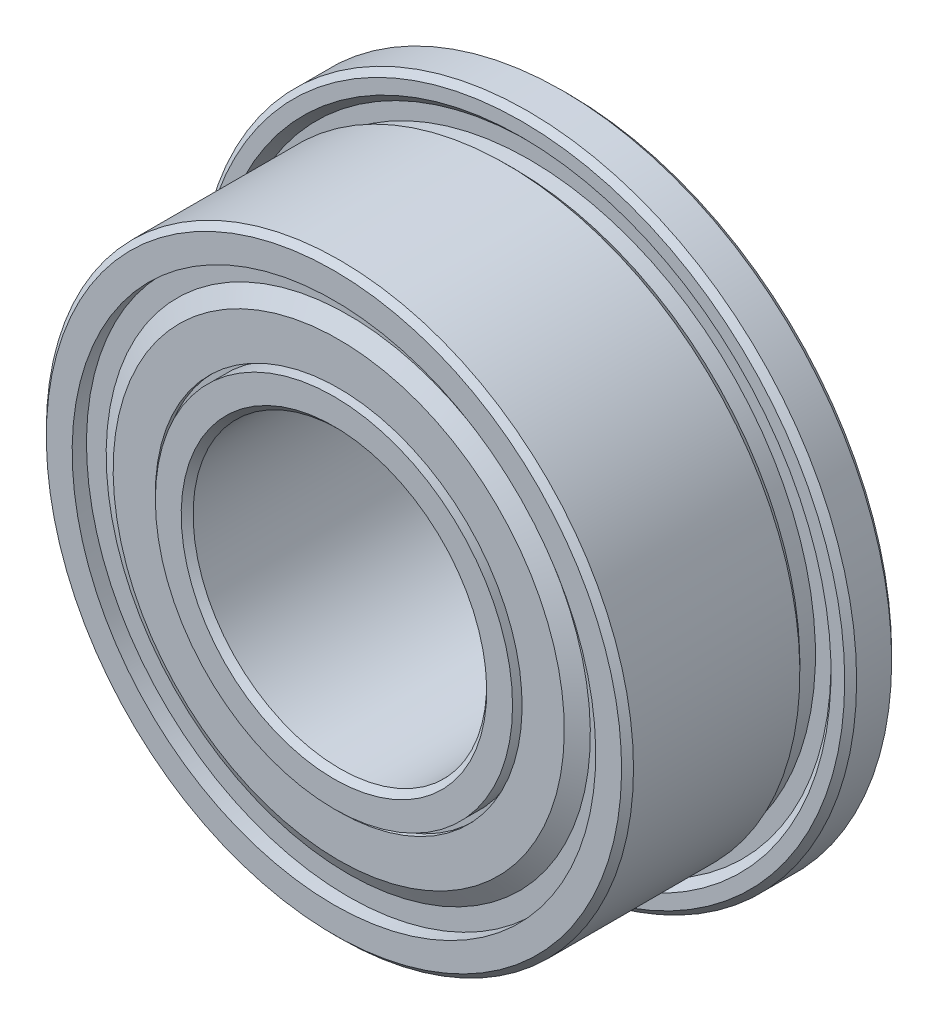
from build123d import *

# Parameters (mm, degrees)
FILLET1_SIZE      = 0.1015625
FILLET2_SIZE      = 0.1015625
CIRPATTERN3_COUNT = 16
SKETCH8_W         = 0.325
SKETCH8_H         = 0.270833333


with BuildPart() as part:
    # Sketch2 → Revolve1 (revolve)
    with BuildSketch(Plane(origin=(0, 0, 0), x_dir=(0, 0, -1), z_dir=(1, 0, 0)), mode=Mode.PRIVATE) as revolve1_sk:
        with BuildLine():
            Line((2, 5.6), (1.2, 5.6))
            Line((1.2, 5.6), (1.2, 5.265165043))
            Line((1.2, 5.265165043), (1.332582521, 5.132582521))
            Line((1.332582521, 5.132582521), (1.332582521, 4.867417479))
            Line((1.332582521, 4.867417479), (1.067417479, 4.867417479))
            Line((1.067417479, 4.867417479), (0.934834957, 5))
            Line((0.934834957, 5), (-2, 5))
            Line((-2, 5), (-2, 4.1875))
            Line((-2, 4.1875), (-0.410601693, 4.1875))
            ThreePointArc((-0.410601693, 4.1875), (0, 4.35), (0.410601693, 4.1875))
            Line((0.410601693, 4.1875), (2, 4.1875))
            Line((2, 4.1875), (2, 5.6))
        make_face()
        with BuildLine():
            Line((2, 2.5), (-2, 2.5))
            Line((-2, 2.5), (-2, 3.3125))
            Line((-2, 3.3125), (-0.410601693, 3.3125))
            ThreePointArc((-0.410601693, 3.3125), (0, 3.15), (0.410601693, 3.3125))
            Line((0.410601693, 3.3125), (2, 3.3125))
            Line((2, 3.3125), (2, 2.5))
        make_face()
    revolve(revolve1_sk.sketch.rotate(Axis((0, 0, 0), (0, 0, -1)), 180), axis=Axis((0, 0, 0), (0, 0, -1)))

    # Fillet1
    fillet1_edges = [part.edges().sort_by_distance(p)[0] for p in [
        (0, 5, 2),
        (0, 5.6, -2),
        (0, 5.6, -1.2),
    ]]
    chamfer(fillet1_edges, length=FILLET1_SIZE)

    # Fillet2
    fillet2_edges = [part.edges().sort_by_distance(p)[0] for p in [
        (0, 2.5, -2),
        (0, 2.5, 2),
    ]]
    chamfer(fillet2_edges, length=FILLET2_SIZE)

    # Sketch8 → Cut-Revolve1 (revolve, cut)
    with BuildSketch(Plane(origin=(0, 0, 0), x_dir=(0, 0, -1), z_dir=(1, 0, 0)), mode=Mode.PRIVATE) as cut_revolve1_sk:
        with Locations((-1.8375, 4.322916667)):
            Rectangle(SKETCH8_W, SKETCH8_H)
        with Locations((1.8375, 4.322916667)):
            Rectangle(SKETCH8_W, SKETCH8_H)
        with Locations((1.8375, 3.177083334)):
            Rectangle(SKETCH8_W, SKETCH8_H)
        with Locations((-1.8375, 3.177083334)):
            Rectangle(SKETCH8_W, SKETCH8_H)
    revolve(cut_revolve1_sk.sketch.rotate(Axis((0, 0, 0), (0, 0, -1)), 180), axis=Axis((0, 0, 0), (0, 0, -1)), mode=Mode.SUBTRACT)


with BuildPart() as body_2:
    # Sketch7 → Revolve3 (revolve)
    with BuildSketch(Plane.XY):
        with BuildLine():
            Line((0, 4.35), (0, 3.15))
            ThreePointArc((0, 3.15), (-0.6, 3.75), (0, 4.35))
        make_face()
    revolve(axis=Axis((0, 4.35, 0), (0, -1, 0)))


with BuildPart() as cirpattern3_1:
    # CirPattern3: pattern copy
    add(body_2.part.rotate(Axis((0, 0, 0), (0, 0, 1)), 1 * 360 / CIRPATTERN3_COUNT))


with BuildPart() as cirpattern3_2:
    # CirPattern3: pattern copy
    add(body_2.part.rotate(Axis((0, 0, 0), (0, 0, 1)), 2 * 360 / CIRPATTERN3_COUNT))


with BuildPart() as cirpattern3_3:
    # CirPattern3: pattern copy
    add(body_2.part.rotate(Axis((0, 0, 0), (0, 0, 1)), 3 * 360 / CIRPATTERN3_COUNT))


with BuildPart() as cirpattern3_4:
    # CirPattern3: pattern copy
    add(body_2.part.rotate(Axis((0, 0, 0), (0, 0, 1)), 4 * 360 / CIRPATTERN3_COUNT))


with BuildPart() as cirpattern3_5:
    # CirPattern3: pattern copy
    add(body_2.part.rotate(Axis((0, 0, 0), (0, 0, 1)), 5 * 360 / CIRPATTERN3_COUNT))


with BuildPart() as cirpattern3_6:
    # CirPattern3: pattern copy
    add(body_2.part.rotate(Axis((0, 0, 0), (0, 0, 1)), 6 * 360 / CIRPATTERN3_COUNT))


with BuildPart() as cirpattern3_7:
    # CirPattern3: pattern copy
    add(body_2.part.rotate(Axis((0, 0, 0), (0, 0, 1)), 7 * 360 / CIRPATTERN3_COUNT))


with BuildPart() as cirpattern3_8:
    # CirPattern3: pattern copy
    add(body_2.part.rotate(Axis((0, 0, 0), (0, 0, 1)), 8 * 360 / CIRPATTERN3_COUNT))


with BuildPart() as cirpattern3_9:
    # CirPattern3: pattern copy
    add(body_2.part.rotate(Axis((0, 0, 0), (0, 0, 1)), 9 * 360 / CIRPATTERN3_COUNT))


with BuildPart() as cirpattern3_10:
    # CirPattern3: pattern copy
    add(body_2.part.rotate(Axis((0, 0, 0), (0, 0, 1)), 10 * 360 / CIRPATTERN3_COUNT))


with BuildPart() as cirpattern3_11:
    # CirPattern3: pattern copy
    add(body_2.part.rotate(Axis((0, 0, 0), (0, 0, 1)), 11 * 360 / CIRPATTERN3_COUNT))


with BuildPart() as cirpattern3_12:
    # CirPattern3: pattern copy
    add(body_2.part.rotate(Axis((0, 0, 0), (0, 0, 1)), 12 * 360 / CIRPATTERN3_COUNT))


with BuildPart() as cirpattern3_13:
    # CirPattern3: pattern copy
    add(body_2.part.rotate(Axis((0, 0, 0), (0, 0, 1)), 13 * 360 / CIRPATTERN3_COUNT))


with BuildPart() as cirpattern3_14:
    # CirPattern3: pattern copy
    add(body_2.part.rotate(Axis((0, 0, 0), (0, 0, 1)), 14 * 360 / CIRPATTERN3_COUNT))


with BuildPart() as cirpattern3_15:
    # CirPattern3: pattern copy
    add(body_2.part.rotate(Axis((0, 0, 0), (0, 0, 1)), 15 * 360 / CIRPATTERN3_COUNT))


with BuildPart() as body_18:
    # Sketch9 → Revolve4 (revolve)
    with BuildSketch(Plane(origin=(0, 0, 0), x_dir=(0, 0, -1), z_dir=(1, 0, 0)), mode=Mode.PRIVATE) as revolve4_sk:
        Polygon((-1.675, 4.458333333), (-1.675, 4.101190476), (-1.8375, 3.81973222), (-1.8375, 3.122916667), (-1.91875, 3.122916667), (-1.91875, 3.841503092), (-1.75625, 4.122961348), (-1.75625, 4.458333333), align=None)
        Polygon((1.675, 4.458333333), (1.675, 4.101190476), (1.8375, 3.81973222), (1.8375, 3.122916667), (1.91875, 3.122916667), (1.91875, 3.841503092), (1.75625, 4.122961348), (1.75625, 4.458333333), align=None)
    revolve(revolve4_sk.sketch.rotate(Axis((0, 0, 0), (0, 0, -1)), 180), axis=Axis((0, 0, 0), (0, 0, -1)))


solid = Compound([part.part, body_2.part, cirpattern3_1.part, cirpattern3_2.part, cirpattern3_3.part, cirpattern3_4.part, cirpattern3_5.part, cirpattern3_6.part, cirpattern3_7.part, cirpattern3_8.part, cirpattern3_9.part, cirpattern3_10.part, cirpattern3_11.part, cirpattern3_12.part, cirpattern3_13.part, cirpattern3_14.part, cirpattern3_15.part, body_18.part])
